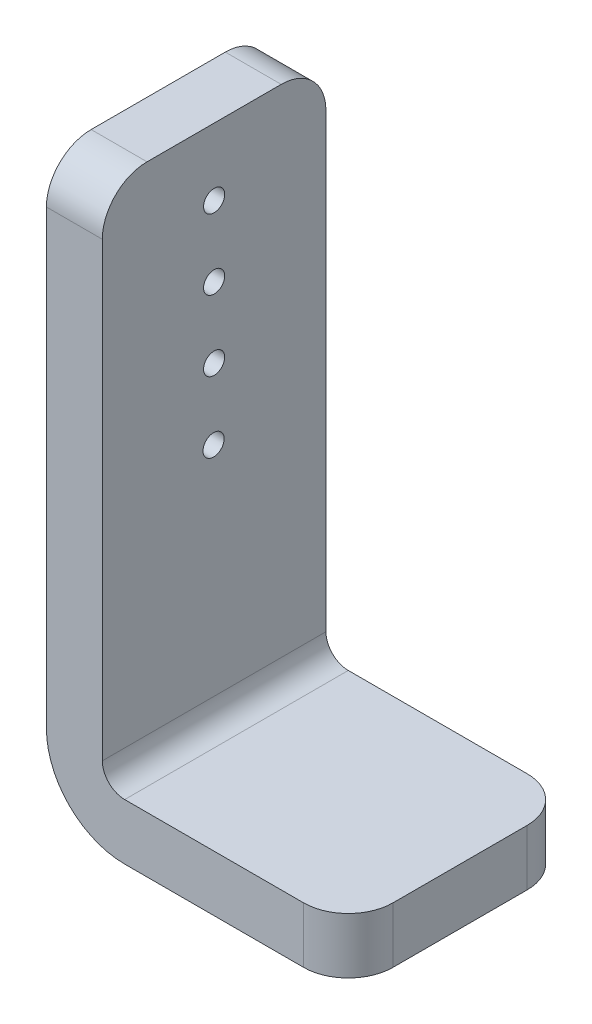
from build123d import *

# Parameters (mm, degrees)
BOSS_EXTRUDE1_DEPTH = 12.7
CUT_EXTRUDE1_REACH  = 28.957
SKETCH2_R           = 0.6
FILLET1_R           = 2.54


with BuildPart() as part:
    # Sketch1 → Boss-Extrude1 (new body)
    with BuildSketch(Plane.XY):
        with BuildLine():
            Line((0, 16.475869837), (0, -11.718130163))
            ThreePointArc((0, -11.718130163), (0.371974388, -12.616155775), (1.27, -12.988130163))
            Line((1.27, -12.988130163), (13.97, -12.988130163))
            Line((13.97, -12.988130163), (13.97, -16.163130163))
            Line((13.97, -16.163130163), (1.27, -16.163130163))
            ThreePointArc((1.27, -16.163130163), (-1.873089642, -14.861219805), (-3.175, -11.718130163))
            Line((-3.175, -11.718130163), (-3.175, 16.475869837))
            Line((-3.175, 16.475869837), (0, 16.475869837))
        make_face()
    extrude(amount=BOSS_EXTRUDE1_DEPTH)

    # Sketch2 → Cut-Extrude1 (cut, up to next)
    with BuildSketch(Plane.ZY.offset(3.175), mode=Mode.PRIVATE) as cut_extrude1_sk1:
        with Locations((6.35, 12.665869837)):
            Circle(SKETCH2_R)
    cut_extrude1_tool1 = extrude(cut_extrude1_sk1.sketch, amount=-CUT_EXTRUDE1_REACH, mode=Mode.PRIVATE) & part.part
    # Sketch2 → Cut-Extrude1 (cut, up to next)
    with BuildSketch(Plane.ZY.offset(3.175), mode=Mode.PRIVATE) as cut_extrude1_sk2:
        with Locations((6.35, 8.665869837)):
            Circle(SKETCH2_R)
    cut_extrude1_tool2 = extrude(cut_extrude1_sk2.sketch, amount=-CUT_EXTRUDE1_REACH, mode=Mode.PRIVATE) & part.part
    # Sketch2 → Cut-Extrude1 (cut, up to next)
    with BuildSketch(Plane.ZY.offset(3.175), mode=Mode.PRIVATE) as cut_extrude1_sk3:
        with Locations((6.35, 4.665877837)):
            Circle(SKETCH2_R)
    cut_extrude1_tool3 = extrude(cut_extrude1_sk3.sketch, amount=-CUT_EXTRUDE1_REACH, mode=Mode.PRIVATE) & part.part
    # Sketch2 → Cut-Extrude1 (cut, up to next)
    with BuildSketch(Plane.ZY.offset(3.175), mode=Mode.PRIVATE) as cut_extrude1_sk4:
        with Locations((6.380886644, 0.665885837)):
            Circle(SKETCH2_R)
    cut_extrude1_tool4 = extrude(cut_extrude1_sk4.sketch, amount=-CUT_EXTRUDE1_REACH, mode=Mode.PRIVATE) & part.part
    add(cut_extrude1_tool1.solids().sort_by_distance((-3.175, 12.66587, 6.35))[0], mode=Mode.SUBTRACT)
    add(cut_extrude1_tool2.solids().sort_by_distance((-3.175, 8.66587, 6.35))[0], mode=Mode.SUBTRACT)
    add(cut_extrude1_tool3.solids().sort_by_distance((-3.175, 4.665878, 6.35))[0], mode=Mode.SUBTRACT)
    add(cut_extrude1_tool4.solids().sort_by_distance((-3.175, 0.665886, 6.380887))[0], mode=Mode.SUBTRACT)

    # Fillet1
    fillet1_edges = [part.edges().sort_by_distance(p)[0] for p in [
        (13.97, -14.575630163, 0),
        (13.97, -14.575630163, 12.7),
        (-1.5875, 16.475869837, 0),
        (-1.5875, 16.475869837, 12.7),
    ]]
    fillet(fillet1_edges, radius=FILLET1_R)


solid = part.part
